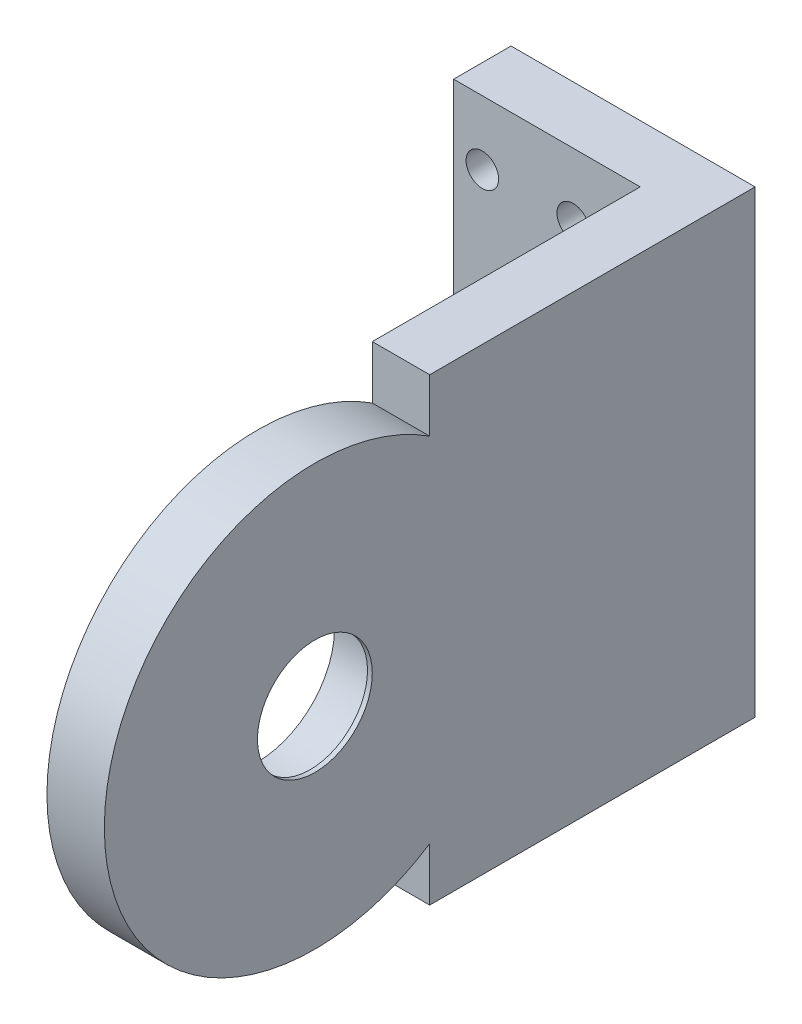
from build123d import *

# Parameters (mm, degrees)
SKETCH1_R           = 22
BOSS_EXTRUDE1_DEPTH = 6
SKETCH2_W           = 34
SKETCH2_H           = 48
BOSS_EXTRUDE2_DEPTH = 6
SKETCH3_R           = 6
CUT_EXTRUDE1_DEPTH  = 6
SKETCH4_R           = 8.05
CUT_EXTRUDE2_DEPTH  = 5.5
SKETCH5_W           = 19.51
SKETCH5_H           = 48
SKETCH5_R           = 1.7
BOSS_EXTRUDE3_DEPTH = 6


with BuildPart() as part:
    # Sketch1 → Boss-Extrude1 (new body)
    with BuildSketch(Plane(origin=(336.5, 0, 0), x_dir=(0, 0, -1), z_dir=(1, 0, 0))):
        with Locations((-300, 300)):
            Circle(SKETCH1_R)
    extrude(amount=BOSS_EXTRUDE1_DEPTH)

    # Sketch2 → Boss-Extrude2 (add)
    with BuildSketch(Plane(origin=(336.5, 0, 0), x_dir=(0, 0, -1), z_dir=(1, 0, 0))):
        with Locations((-271, 300)):
            Rectangle(SKETCH2_W, SKETCH2_H)
    extrude(amount=BOSS_EXTRUDE2_DEPTH)

    # Sketch3 → Cut-Extrude1 (cut)
    with BuildSketch(Plane(origin=(336.5, 0, 0), x_dir=(0, 0, -1), z_dir=(1, 0, 0))):
        with Locations((-300, 300)):
            Circle(SKETCH3_R)
    extrude(amount=CUT_EXTRUDE1_DEPTH, mode=Mode.SUBTRACT)

    # Sketch4 → Cut-Extrude2 (cut)
    with BuildSketch(Plane(origin=(336.5, 0, 0), x_dir=(0, 0, -1), z_dir=(1, 0, 0))):
        with Locations((-300, 300)):
            Circle(SKETCH4_R)
    extrude(amount=CUT_EXTRUDE2_DEPTH, mode=Mode.SUBTRACT)

    # Sketch5 → Boss-Extrude3 (add)
    with BuildSketch(Plane.XY.offset(254)):
        with Locations((326.755, 300)):
            Rectangle(SKETCH5_W, SKETCH5_H)
        with Locations((320, 282.7)):
            Circle(SKETCH5_R, mode=Mode.SUBTRACT)
        with Locations((320, 317.3)):
            Circle(SKETCH5_R, mode=Mode.SUBTRACT)
        with Locations((329.5, 282.7)):
            Circle(SKETCH5_R, mode=Mode.SUBTRACT)
        with Locations((329.5, 317.3)):
            Circle(SKETCH5_R, mode=Mode.SUBTRACT)
    extrude(amount=BOSS_EXTRUDE3_DEPTH)


solid = part.part
